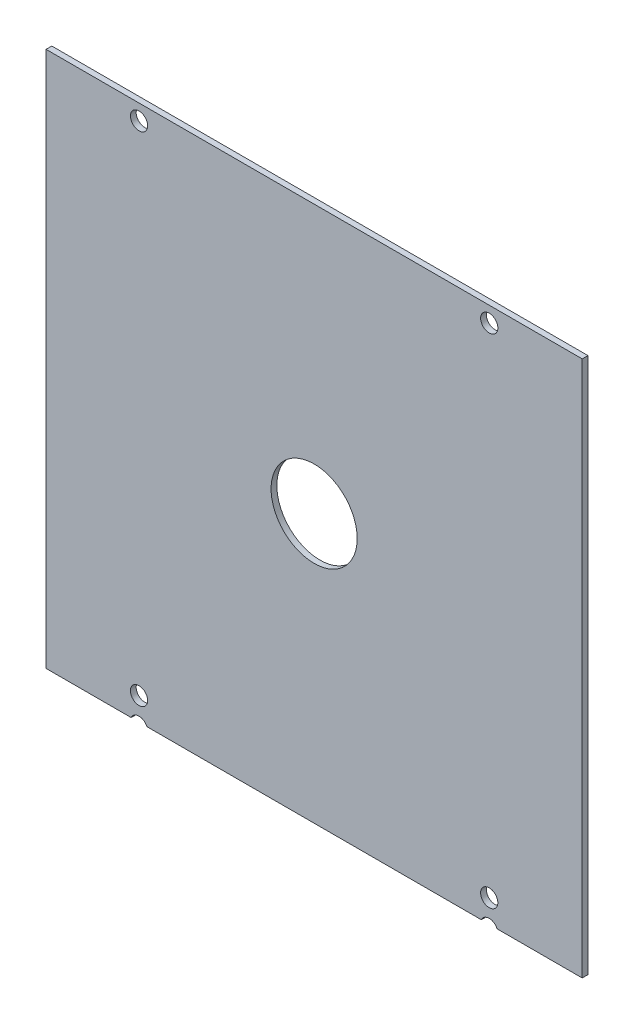
from build123d import *

# Parameters (mm, degrees)
SKETCH1_W                    = 93.4
SKETCH1_H                    = 93.4
BOSS_EXTRUDE1_DEPTH          = 1
F_3_0_3_DIAMETER_HOLE1_D     = 3
F_3_0_3_DIAMETER_HOLE1_DEPTH = 1
SKETCH_1_R                   = 7.5
CUT_EXTRUDE_1_DEPTH          = 67.051343665


with BuildPart() as part:
    # Sketch1 → Boss-Extrude1 (new body)
    with BuildSketch(Plane.XY):
        Rectangle(SKETCH1_W, SKETCH1_H)
    extrude(amount=BOSS_EXTRUDE1_DEPTH)

    # Ø3.0 (3) Diameter Hole1
    with Locations(Plane.XY.offset(1)):
        with Locations((-30.5, -47.3), (30.5, -47.3), (30.5, -42.7), (-30.5, -42.7), (-30.5, 44), (30.5, 44), (-30.5, -66), (30.5, -66)):
            Hole(F_3_0_3_DIAMETER_HOLE1_D / 2, depth=F_3_0_3_DIAMETER_HOLE1_DEPTH)

    # Эскиз1 → Вырез-Вытянуть1 (cut, through all)
    with BuildSketch(Plane.XY.offset(1)):
        Circle(SKETCH_1_R)
    extrude(amount=-CUT_EXTRUDE_1_DEPTH, mode=Mode.SUBTRACT)


solid = part.part
